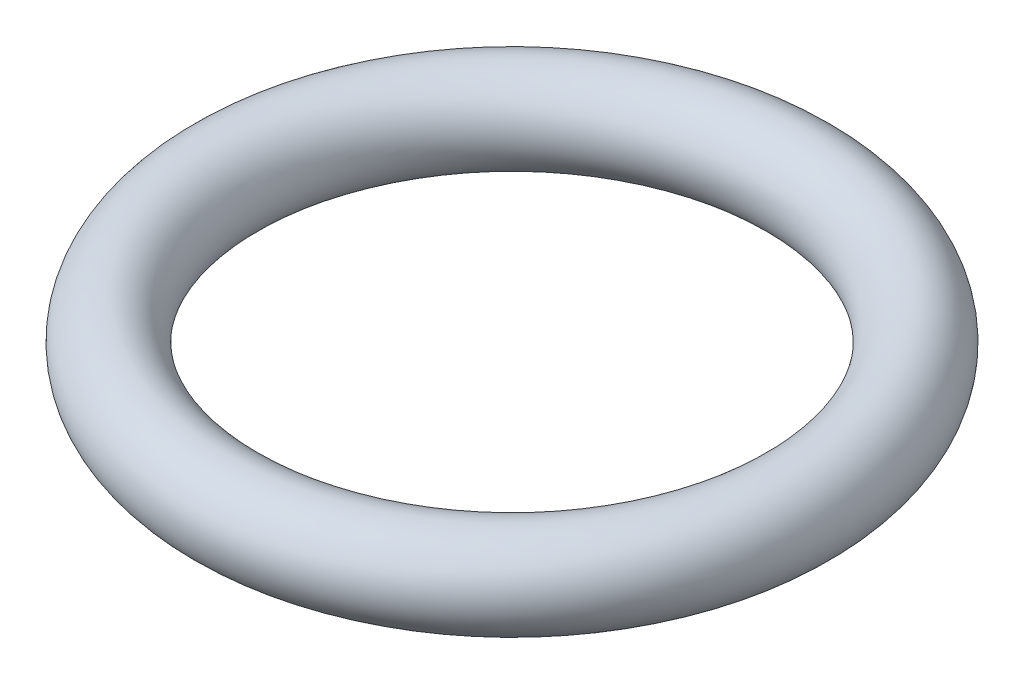
from build123d import *

# Parameters (mm, degrees)
SKETCH1_R = 0.85


with BuildPart() as part:
    # Sketch1 → Revolve1 (revolve)
    with BuildSketch(Plane.XY, mode=Mode.PRIVATE) as revolve1_sk:
        with Locations((-5.5, 0)):
            Circle(SKETCH1_R)
    revolve(revolve1_sk.sketch.rotate(Axis((0, -3.97209602, 0), (0, 1, 0)), 270), axis=Axis((0, -3.97209602, 0), (0, 1, 0)))


solid = part.part
